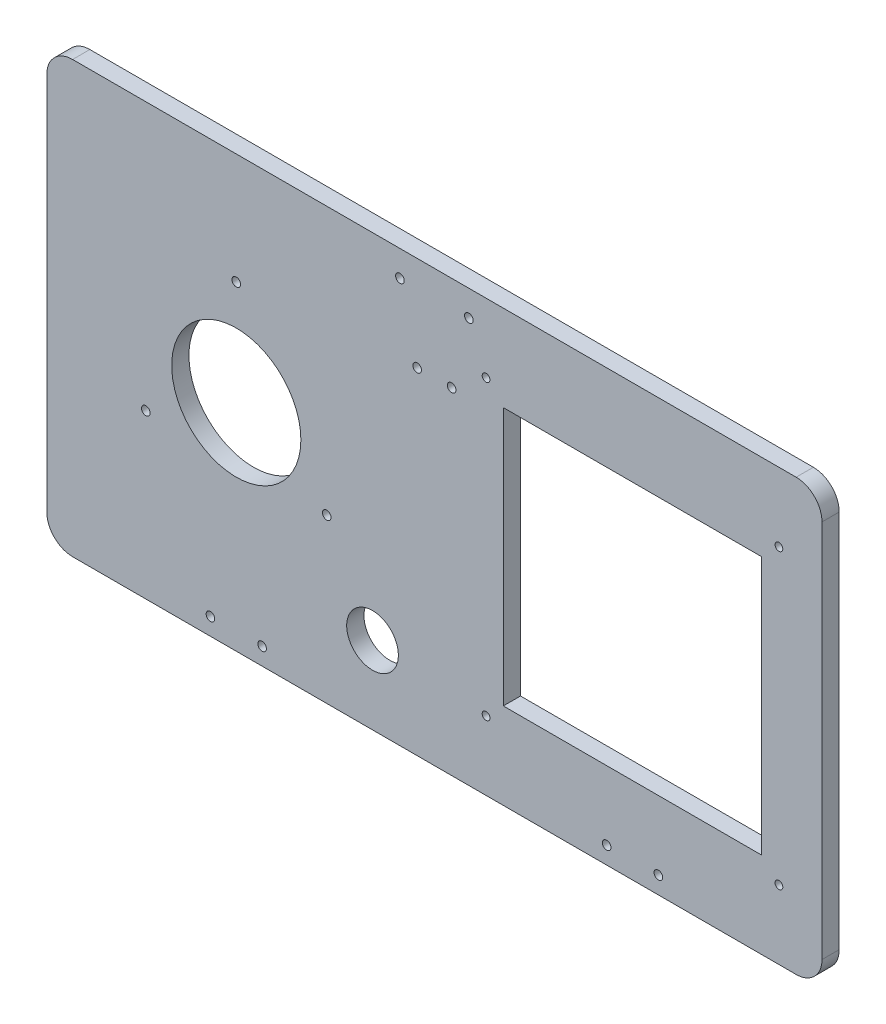
from build123d import *

# Parameters (mm, degrees)
CROQUIS1_R              = 2.5
CROQUIS1_R_2            = 37.5
CROQUIS1_R_3            = 15
CROQUIS1_R_4            = 2.25
CROQUIS1_W              = 150
CROQUIS1_H              = 150
SALIENTE_EXTRUIR1_DEPTH = 10


with BuildPart() as part:
    # Croquis1 → Saliente-Extruir1 (new body)
    with BuildSketch(Plane.XY):
        with BuildLine():
            Line((15, 0), (435, 0))
            ThreePointArc((435, 0), (445.606601718, 4.393398282), (450, 15))
            Line((450, 15), (450, 235))
            ThreePointArc((450, 235), (445.606601718, 245.606601718), (435, 250))
            Line((435, 250), (15, 250))
            ThreePointArc((15, 250), (4.393398282, 245.606601718), (0, 235))
            Line((0, 235), (0, 15))
            ThreePointArc((0, 15), (4.393398282, 4.393398282), (15, 0))
        make_face()
        with Locations((110, 185.621778265)):
            Circle(CROQUIS1_R, mode=Mode.SUBTRACT)
        with Locations((162.5, 94.689110868)):
            Circle(CROQUIS1_R, mode=Mode.SUBTRACT)
        with Locations((57.5, 94.689110868)):
            Circle(CROQUIS1_R, mode=Mode.SUBTRACT)
        with Locations((110, 125)):
            Circle(CROQUIS1_R_2, mode=Mode.SUBTRACT)
        with Locations((205, 235)):
            Circle(CROQUIS1_R, mode=Mode.SUBTRACT)
        with Locations((245, 235)):
            Circle(CROQUIS1_R, mode=Mode.SUBTRACT)
        with Locations((189.096460098, 45)):
            Circle(CROQUIS1_R_3, mode=Mode.SUBTRACT)
        with Locations((425, 210)):
            Circle(CROQUIS1_R_4, mode=Mode.SUBTRACT)
        with Locations((255, 210)):
            Circle(CROQUIS1_R_4, mode=Mode.SUBTRACT)
        with Locations((255, 40)):
            Circle(CROQUIS1_R_4, mode=Mode.SUBTRACT)
        with Locations((425, 40)):
            Circle(CROQUIS1_R_4, mode=Mode.SUBTRACT)
        with Locations((325, 10)):
            Circle(CROQUIS1_R, mode=Mode.SUBTRACT)
        with Locations((355, 10)):
            Circle(CROQUIS1_R, mode=Mode.SUBTRACT)
        with Locations(Location((95, 10, 0), (0, 0, 180))):
            Circle(CROQUIS1_R, mode=Mode.SUBTRACT)
        with Locations(Location((125, 10, 0), (0, 0, 180))):
            Circle(CROQUIS1_R, mode=Mode.SUBTRACT)
        with Locations((215, 195)):
            Circle(CROQUIS1_R, mode=Mode.SUBTRACT)
        with Locations((235, 195)):
            Circle(CROQUIS1_R, mode=Mode.SUBTRACT)
        with Locations((340, 125)):
            Rectangle(CROQUIS1_W, CROQUIS1_H, mode=Mode.SUBTRACT)
    extrude(amount=SALIENTE_EXTRUIR1_DEPTH)


solid = part.part
